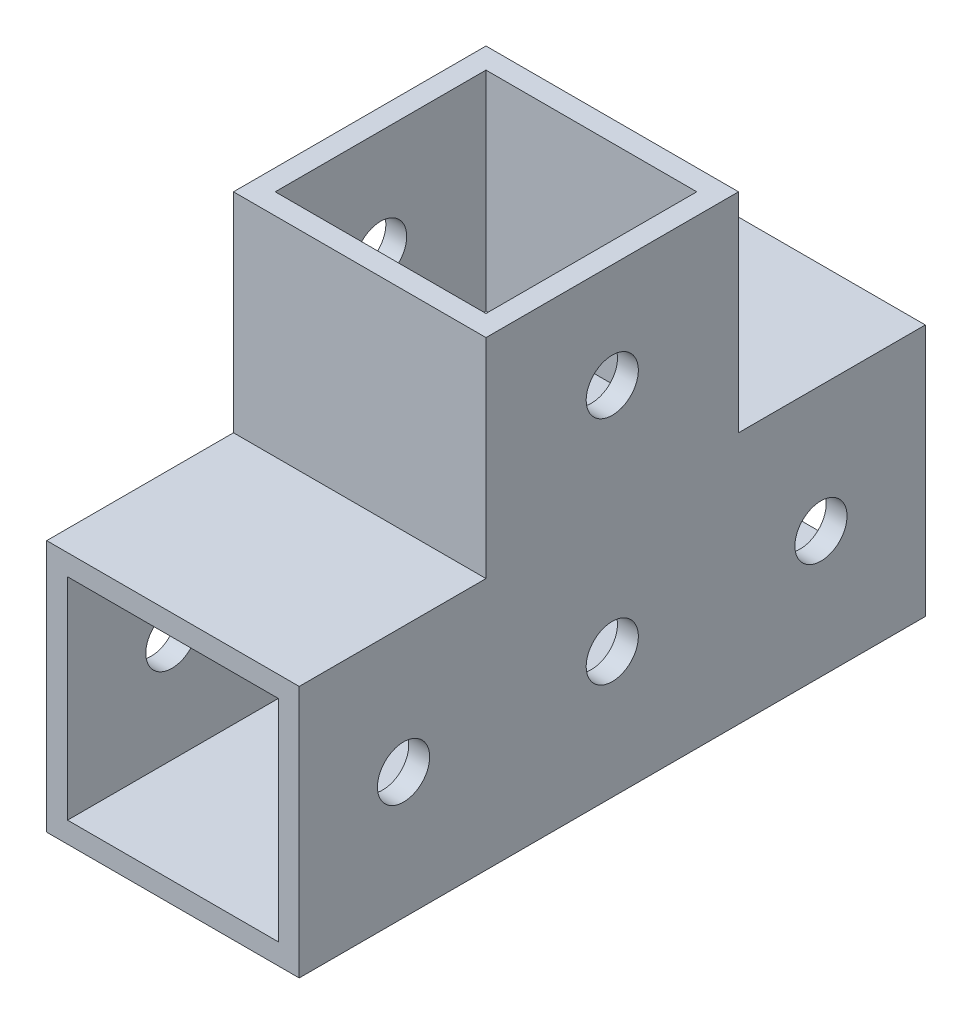
from build123d import *

# Parameters (mm, degrees)
SKETCH_2_W          = 24.2
SKETCH_2_H          = 24.2
SKETCH_2_W_2        = 20.2
SKETCH_2_H_2        = 20.2
EXTRUDE_4_DEPTH     = 100
SKETCH_6_W          = 24.2
SKETCH_6_H          = 24.2
SKETCH_6_W_2        = 20.2
SKETCH_6_H_2        = 20.2
EXTRUDE_5_DEPTH     = 40
SKETCH_7_R          = 2.5
CUT_EXTRUDE_1_DEPTH = 40
SKETCH_8_R          = 2.5
CUT_EXTRUDE_2_DEPTH = 40
CUT_EXTRUDE_START   = -40
SKETCH_9_W          = 20
SKETCH_9_H          = 24.2
SKETCH_9_R          = 2.5
CUT_EXTRUDE_3_DEPTH = 40
SKETCH_10_W         = 24.2
SKETCH_10_H         = 20
SKETCH_10_R         = 2.5
CUT_EXTRUDE_4_DEPTH = 40


with BuildPart() as part:
    # 草图2 → 凸台-拉伸4 (new body)
    with BuildSketch(Plane.XY):
        Rectangle(SKETCH_2_W, SKETCH_2_H)
        Rectangle(SKETCH_2_W_2, SKETCH_2_H_2, mode=Mode.SUBTRACT)
    extrude(amount=EXTRUDE_4_DEPTH)

    # 草图6 → 凸台-拉伸5 (add)
    with BuildSketch(Plane(origin=(0, 12.1, 0), x_dir=(1, 0, 0), z_dir=(0, 1, 0))):
        with Locations((0, -50)):
            Rectangle(SKETCH_6_W, SKETCH_6_H)
        with Locations((0, -50)):
            Rectangle(SKETCH_6_W_2, SKETCH_6_H_2, mode=Mode.SUBTRACT)
    extrude(amount=EXTRUDE_5_DEPTH)

    # 草图7 → 切除-拉伸1 (cut)
    with BuildSketch(Plane.ZY.offset(12.1)):
        with Locations((10, 0)):
            Circle(SKETCH_7_R)
        with Locations((30, 0)):
            Circle(SKETCH_7_R)
        with Locations(Location((90, 0, 0), (0, 0, 180))):
            Circle(SKETCH_7_R)
        with Locations(Location((70, 0, 0), (0, 0, 180))):
            Circle(SKETCH_7_R)
        with Locations((50, 42.1)):
            Circle(SKETCH_7_R)
        with Locations((50, 22.1)):
            Circle(SKETCH_7_R)
    extrude(amount=-CUT_EXTRUDE_1_DEPTH, mode=Mode.SUBTRACT)

    # 草图8 → 切除-拉伸2 (cut)
    with BuildSketch(Plane(origin=(12.1, 0, 0), x_dir=(0, 0, -1), z_dir=(1, 0, 0))):
        with Locations((-50, 0)):
            Circle(SKETCH_8_R)
    extrude(amount=-CUT_EXTRUDE_2_DEPTH, mode=Mode.SUBTRACT)

    # 草图9 → 切除-拉伸3 (cut)
    # profile 1 of 2: a face of its own
    with BuildSketch(Plane(origin=(12.1, 0, 0), x_dir=(0, 0, -1), z_dir=(1, 0, 0)).offset(CUT_EXTRUDE_START)):
        with Locations((-10, 0)):
            Rectangle(SKETCH_9_W, SKETCH_9_H)
        with Locations((-10, 0)):
            Circle(SKETCH_9_R, mode=Mode.SUBTRACT)
    # profile 2 of 2: a face of its own
    with BuildSketch(Plane(origin=(12.1, 0, 0), x_dir=(0, 0, -1), z_dir=(1, 0, 0)).offset(CUT_EXTRUDE_START)):
        with Locations((-90, 0)):
            Rectangle(SKETCH_9_W, SKETCH_9_H)
        with Locations((-90, 0)):
            Circle(SKETCH_9_R, mode=Mode.SUBTRACT)
    extrude(amount=CUT_EXTRUDE_3_DEPTH, mode=Mode.SUBTRACT)

    # 草图10 → 切除-拉伸4 (cut)
    with BuildSketch(Plane(origin=(12.1, 0, 0), x_dir=(0, 0, -1), z_dir=(1, 0, 0)).offset(CUT_EXTRUDE_START)):
        with Locations((-50, 42.1)):
            Rectangle(SKETCH_10_W, SKETCH_10_H)
        with Locations((-50, 42.1)):
            Circle(SKETCH_10_R, mode=Mode.SUBTRACT)
    extrude(amount=CUT_EXTRUDE_4_DEPTH, mode=Mode.SUBTRACT)


solid = part.part
